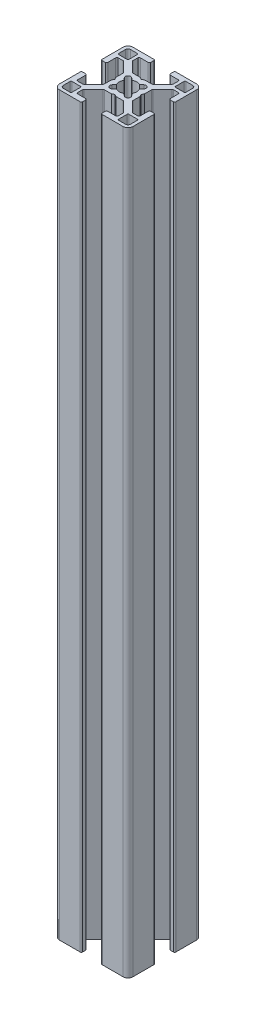
from build123d import *

# Parameters (mm, degrees)
EXTRUDE1_DEPTH = 300


with BuildPart() as part:
    # Sketch1 → Extrude1 (new body)
    with BuildSketch(Plane(origin=(0, 0, 0), x_dir=(1, 0, 0), z_dir=(0, 1, 0))):
        with BuildLine():
            Line((300.053103973, -32.880446014), (300.053103973, -36.112965336))
            ThreePointArc((300.053103973, -36.112965336), (299.91307902, -36.47774281), (299.553410558, -36.630413014))
            Line((299.553410558, -36.630413014), (297.570817355, -36.630413014))
            ThreePointArc((297.570817355, -36.630413014), (297.379476404, -36.592352933), (297.217265379, -36.48396699))
            Line((297.217265379, -36.48396699), (293.291747091, -32.558448703))
            ThreePointArc((293.291747091, -32.558448703), (293.183361149, -32.396237678), (293.145301068, -32.204896727))
            Line((293.145301068, -32.204896727), (293.145301068, -29.392941964))
            Line((293.145301068, -29.392941964), (292.635303108, -28.442945764))
            Line((292.635303108, -28.442945764), (293.145301068, -27.492949564))
            Line((293.145301068, -27.492949564), (293.145301068, -24.555995301))
            ThreePointArc((293.145301068, -24.555995301), (293.183361149, -24.36465435), (293.291747091, -24.202443325))
            Line((293.291747091, -24.202443325), (297.217265379, -20.276925038))
            ThreePointArc((297.217265379, -20.276925038), (297.379476404, -20.168539096), (297.570817355, -20.130479014))
            Line((297.570817355, -20.130479014), (299.553410558, -20.130479014))
            ThreePointArc((299.553410558, -20.130479014), (299.91307902, -20.283149218), (300.053103973, -20.647926693))
            Line((300.053103973, -20.647926693), (300.053103973, -23.880446014))
            ThreePointArc((300.053103973, -23.880446014), (300.199550583, -24.233999405), (300.553103973, -24.380446014))
            Line((300.553103973, -24.380446014), (301.810569323, -24.380446014))
            ThreePointArc((301.810569323, -24.380446014), (302.164122713, -24.233999405), (302.310569323, -23.880446014))
            Line((302.310569323, -23.880446014), (302.310569323, -15.380498014))
            ThreePointArc((302.310569323, -15.380498014), (301.724785228, -13.966290108), (300.310577323, -13.380506014))
            Line((300.310577323, -13.380506014), (291.810629323, -13.380506014))
            ThreePointArc((291.810629323, -13.380506014), (291.457075932, -13.526952623), (291.310629323, -13.880506014))
            Line((291.310629323, -13.880506014), (291.310629323, -15.137971364))
            ThreePointArc((291.310629323, -15.137971364), (291.457075932, -15.491524754), (291.810629323, -15.637971364))
            Line((291.810629323, -15.637971364), (295.043148644, -15.637971364))
            ThreePointArc((295.043148644, -15.637971364), (295.407926119, -15.777996317), (295.560596323, -16.137664778))
            Line((295.560596323, -16.137664778), (295.560596323, -18.120257982))
            ThreePointArc((295.560596323, -18.120257982), (295.522536241, -18.311598933), (295.414150299, -18.473809958))
            Line((295.414150299, -18.473809958), (291.488632012, -22.399328245))
            ThreePointArc((291.488632012, -22.399328245), (291.326420986, -22.507714187), (291.135080036, -22.545774269))
            Line((291.135080036, -22.545774269), (288.260625523, -22.545774269))
            Line((288.260625523, -22.545774269), (287.310629323, -23.055772229))
            Line((287.310629323, -23.055772229), (286.360633123, -22.545774269))
            Line((286.360633123, -22.545774269), (283.48617861, -22.545774269))
            ThreePointArc((283.48617861, -22.545774269), (283.294837659, -22.507714187), (283.132626634, -22.399328245))
            Line((283.132626634, -22.399328245), (279.207108346, -18.473809958))
            ThreePointArc((279.207108346, -18.473809958), (279.098722404, -18.311598933), (279.060662323, -18.120257982))
            Line((279.060662323, -18.120257982), (279.060662323, -16.137664778))
            ThreePointArc((279.060662323, -16.137664778), (279.213332527, -15.777996317), (279.578110001, -15.637971364))
            Line((279.578110001, -15.637971364), (282.810629323, -15.637971364))
            ThreePointArc((282.810629323, -15.637971364), (283.164182713, -15.491524754), (283.310629323, -15.137971364))
            Line((283.310629323, -15.137971364), (283.310629323, -13.880506014))
            ThreePointArc((283.310629323, -13.880506014), (283.164182713, -13.526952623), (282.810629323, -13.380506014))
            Line((282.810629323, -13.380506014), (274.310681323, -13.380506014))
            ThreePointArc((274.310681323, -13.380506014), (272.896473417, -13.966290108), (272.310689323, -15.380498014))
            Line((272.310689323, -15.380498014), (272.310689323, -23.880446014))
            ThreePointArc((272.310689323, -23.880446014), (272.457135932, -24.233999405), (272.810689323, -24.380446014))
            Line((272.810689323, -24.380446014), (274.068154672, -24.380446014))
            ThreePointArc((274.068154672, -24.380446014), (274.421708063, -24.233999405), (274.568154672, -23.880446014))
            Line((274.568154672, -23.880446014), (274.568154672, -20.647926693))
            ThreePointArc((274.568154672, -20.647926693), (274.708179626, -20.283149218), (275.067848087, -20.130479014))
            Line((275.067848087, -20.130479014), (277.05044129, -20.130479014))
            ThreePointArc((277.05044129, -20.130479014), (277.241782241, -20.168539096), (277.403993267, -20.276925038))
            Line((277.403993267, -20.276925038), (281.329511554, -24.202443325))
            ThreePointArc((281.329511554, -24.202443325), (281.437897496, -24.36465435), (281.475957578, -24.555995301))
            Line((281.475957578, -24.555995301), (281.475957578, -27.492949564))
            Line((281.475957578, -27.492949564), (281.985955538, -28.442945764))
            Line((281.985955538, -28.442945764), (281.475957578, -29.392941964))
            Line((281.475957578, -29.392941964), (281.475957578, -32.204896727))
            ThreePointArc((281.475957578, -32.204896727), (281.437897496, -32.396237678), (281.329511554, -32.558448703))
            Line((281.329511554, -32.558448703), (277.403993267, -36.48396699))
            ThreePointArc((277.403993267, -36.48396699), (277.241782241, -36.592352933), (277.05044129, -36.630413014))
            Line((277.05044129, -36.630413014), (275.067848087, -36.630413014))
            ThreePointArc((275.067848087, -36.630413014), (274.708179626, -36.47774281), (274.568154672, -36.112965336))
            Line((274.568154672, -36.112965336), (274.568154672, -32.880446014))
            ThreePointArc((274.568154672, -32.880446014), (274.421708063, -32.526892623), (274.068154672, -32.380446014))
            Line((274.068154672, -32.380446014), (272.810689323, -32.380446014))
            ThreePointArc((272.810689323, -32.380446014), (272.457135932, -32.526892623), (272.310689323, -32.880446014))
            Line((272.310689323, -32.880446014), (272.310689323, -41.380394014))
            ThreePointArc((272.310689323, -41.380394014), (272.896473417, -42.79460192), (274.310681323, -43.380386014))
            Line((274.310681323, -43.380386014), (282.810629323, -43.380386014))
            ThreePointArc((282.810629323, -43.380386014), (283.164182713, -43.233939405), (283.310629323, -42.880386014))
            Line((283.310629323, -42.880386014), (283.310629323, -41.622920664))
            ThreePointArc((283.310629323, -41.622920664), (283.164182713, -41.269367274), (282.810629323, -41.122920664))
            Line((282.810629323, -41.122920664), (279.578110001, -41.122920664))
            ThreePointArc((279.578110001, -41.122920664), (279.213332527, -40.982895711), (279.060662323, -40.62322725))
            Line((279.060662323, -40.62322725), (279.060662323, -38.640634046))
            ThreePointArc((279.060662323, -38.640634046), (279.098722404, -38.449293096), (279.207108346, -38.28708207))
            Line((279.207108346, -38.28708207), (283.132626634, -34.361563783))
            ThreePointArc((283.132626634, -34.361563783), (283.294837659, -34.253177841), (283.48617861, -34.215117759))
            Line((283.48617861, -34.215117759), (286.360633123, -34.215117759))
            Line((286.360633123, -34.215117759), (287.310629323, -33.705119799))
            Line((287.310629323, -33.705119799), (288.260625523, -34.215117759))
            Line((288.260625523, -34.215117759), (291.135080036, -34.215117759))
            ThreePointArc((291.135080036, -34.215117759), (291.326420986, -34.253177841), (291.488632012, -34.361563783))
            Line((291.488632012, -34.361563783), (295.414150299, -38.28708207))
            ThreePointArc((295.414150299, -38.28708207), (295.522536241, -38.449293096), (295.560596323, -38.640634046))
            Line((295.560596323, -38.640634046), (295.560596323, -40.62322725))
            ThreePointArc((295.560596323, -40.62322725), (295.407926119, -40.982895711), (295.043148644, -41.122920664))
            Line((295.043148644, -41.122920664), (291.810629323, -41.122920664))
            ThreePointArc((291.810629323, -41.122920664), (291.457075932, -41.269367274), (291.310629323, -41.622920664))
            Line((291.310629323, -41.622920664), (291.310629323, -42.880386014))
            ThreePointArc((291.310629323, -42.880386014), (291.457075932, -43.233939405), (291.810629323, -43.380386014))
            Line((291.810629323, -43.380386014), (300.310577323, -43.380386014))
            ThreePointArc((300.310577323, -43.380386014), (301.724785228, -42.79460192), (302.310569323, -41.380394014))
            Line((302.310569323, -41.380394014), (302.310569323, -32.880446014))
            ThreePointArc((302.310569323, -32.880446014), (302.164122713, -32.526892623), (301.810569323, -32.380446014))
            Line((301.810569323, -32.380446014), (300.553103973, -32.380446014))
            ThreePointArc((300.553103973, -32.380446014), (300.199550583, -32.526892623), (300.053103973, -32.880446014))
        make_face()
        with BuildLine():
            Line((296.810591323, -41.699392738), (296.810591323, -38.260406494))
            ThreePointArc((296.810591323, -38.260406494), (296.921890301, -37.991706992), (297.190589803, -37.880408014))
            Line((297.190589803, -37.880408014), (300.629576047, -37.880408014))
            ThreePointArc((300.629576047, -37.880408014), (300.898982653, -37.991999884), (301.010574523, -38.26140649))
            Line((301.010574523, -38.26140649), (301.010574523, -41.080395214))
            ThreePointArc((301.010574523, -41.080395214), (300.717682476, -41.787499167), (300.010578523, -42.080391214))
            Line((300.010578523, -42.080391214), (297.191589799, -42.080391214))
            ThreePointArc((297.191589799, -42.080391214), (296.922183193, -41.968799344), (296.810591323, -41.699392738))
        make_face(mode=Mode.SUBTRACT)
        with BuildLine():
            Line((273.991682599, -37.880408014), (277.430668843, -37.880408014))
            ThreePointArc((277.430668843, -37.880408014), (277.699368345, -37.991706992), (277.810667323, -38.260406494))
            Line((277.810667323, -38.260406494), (277.810667323, -41.699392738))
            ThreePointArc((277.810667323, -41.699392738), (277.699075453, -41.968799344), (277.429668847, -42.080391214))
            Line((277.429668847, -42.080391214), (274.610680123, -42.080391214))
            ThreePointArc((274.610680123, -42.080391214), (273.90357617, -41.787499167), (273.610684123, -41.080395214))
            Line((273.610684123, -41.080395214), (273.610684123, -38.26140649))
            ThreePointArc((273.610684123, -38.26140649), (273.722275993, -37.991999884), (273.991682599, -37.880408014))
        make_face(mode=Mode.SUBTRACT)
        with BuildLine():
            Line((285.816404075, -31.578584726), (284.8372875, -32.36037316))
            ThreePointArc((284.8372875, -32.36037316), (283.410401622, -32.280673715), (283.330702177, -30.853787837))
            Line((283.330702177, -30.853787837), (284.112490611, -29.874671262))
            ThreePointArc((284.112490611, -29.874671262), (283.780643443, -28.380446014), (284.112490611, -26.886220766))
            Line((284.112490611, -26.886220766), (283.330702177, -25.907104192))
            ThreePointArc((283.330702177, -25.907104192), (283.410401622, -24.480218313), (284.8372875, -24.400518869))
            Line((284.8372875, -24.400518869), (285.816404075, -25.182307302))
            ThreePointArc((285.816404075, -25.182307302), (287.310629323, -24.850460134), (288.804854571, -25.182307302))
            Line((288.804854571, -25.182307302), (289.783971145, -24.400518869))
            ThreePointArc((289.783971145, -24.400518869), (291.210857024, -24.480218313), (291.290556468, -25.907104192))
            Line((291.290556468, -25.907104192), (290.508768035, -26.886220766))
            ThreePointArc((290.508768035, -26.886220766), (290.840615203, -28.380446014), (290.508768035, -29.874671262))
            Line((290.508768035, -29.874671262), (291.290556468, -30.853787837))
            ThreePointArc((291.290556468, -30.853787837), (291.210857024, -32.280673715), (289.783971145, -32.36037316))
            Line((289.783971145, -32.36037316), (288.804854571, -31.578584726))
            ThreePointArc((288.804854571, -31.578584726), (287.310629323, -31.910431894), (285.816404075, -31.578584726))
        make_face(mode=Mode.SUBTRACT)
        with BuildLine():
            Line((277.810667323, -15.06149929), (277.810667323, -18.500485534))
            ThreePointArc((277.810667323, -18.500485534), (277.699368345, -18.769185036), (277.430668843, -18.880484014))
            Line((277.430668843, -18.880484014), (273.991682599, -18.880484014))
            ThreePointArc((273.991682599, -18.880484014), (273.722275993, -18.768892144), (273.610684123, -18.499485538))
            Line((273.610684123, -18.499485538), (273.610684123, -15.680496814))
            ThreePointArc((273.610684123, -15.680496814), (273.90357617, -14.973392861), (274.610680123, -14.680500814))
            Line((274.610680123, -14.680500814), (277.429668847, -14.680500814))
            ThreePointArc((277.429668847, -14.680500814), (277.699075453, -14.792092684), (277.810667323, -15.06149929))
        make_face(mode=Mode.SUBTRACT)
        with BuildLine():
            Line((297.191589799, -14.680500814), (300.010578523, -14.680500814))
            ThreePointArc((300.010578523, -14.680500814), (300.717682476, -14.973392861), (301.010574523, -15.680496814))
            Line((301.010574523, -15.680496814), (301.010574523, -18.499485538))
            ThreePointArc((301.010574523, -18.499485538), (300.898982653, -18.768892144), (300.629576047, -18.880484014))
            Line((300.629576047, -18.880484014), (297.190589803, -18.880484014))
            ThreePointArc((297.190589803, -18.880484014), (296.921890301, -18.769185036), (296.810591323, -18.500485534))
            Line((296.810591323, -18.500485534), (296.810591323, -15.06149929))
            ThreePointArc((296.810591323, -15.06149929), (296.922183193, -14.792092684), (297.191589799, -14.680500814))
        make_face(mode=Mode.SUBTRACT)
    extrude(amount=EXTRUDE1_DEPTH)


solid = part.part
